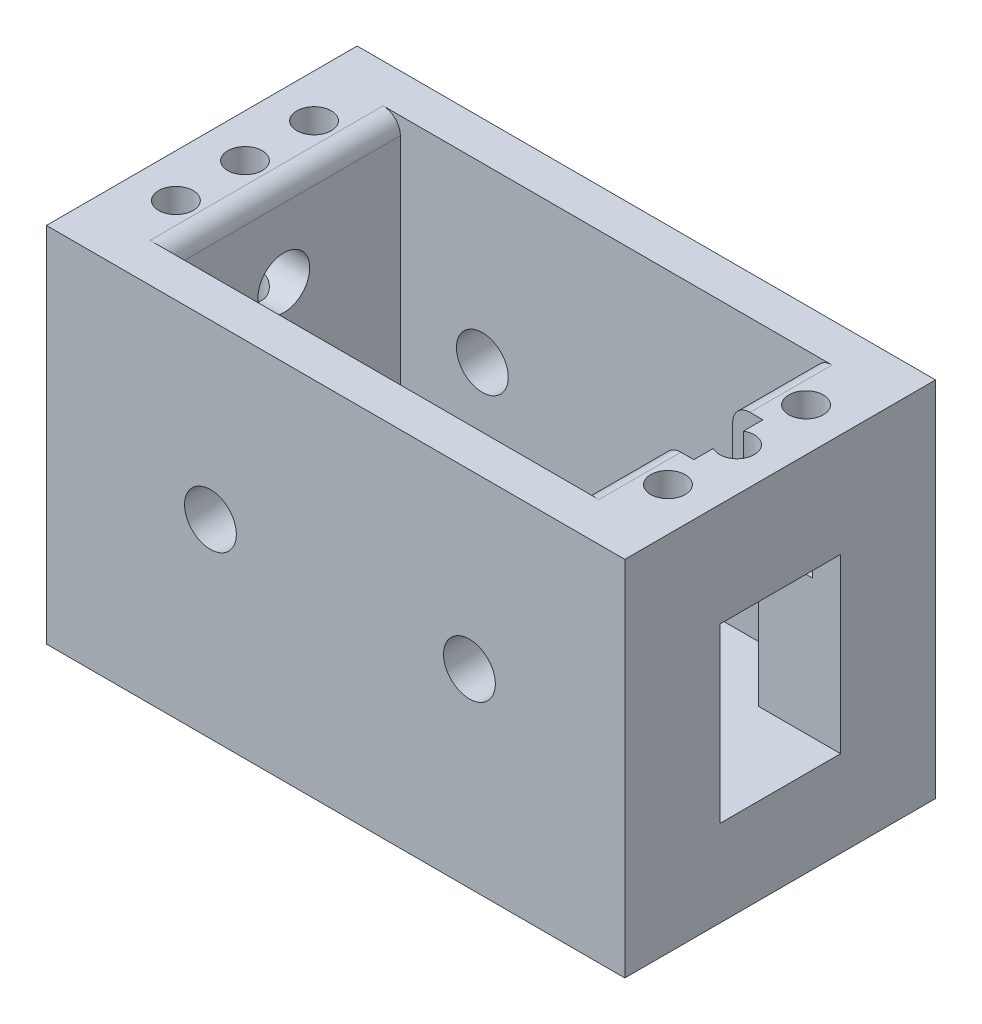
from build123d import *

# Parameters (mm, degrees)
CROQUIS1_W              = 33.5
CROQUIS1_H              = 18
SALIENTE_EXTRUIR1_DEPTH = 21
CROQUIS2_W              = 23.5
CROQUIS2_H              = 13.5
CORTAR_EXTRUIR1_DEPTH   = 16
CORTAR_EXTRUIR2_REACH   = 38.527
CROQUIS3_W              = 7
CROQUIS3_H              = 10
CROQUIS4_R              = 1
CORTAR_EXTRUIR3_DEPTH   = 8
CORTAR_EXTRUIR4_REACH   = 30.33
CROQUIS5_W              = 2
CROQUIS5_H              = 4
CORTAR_EXTRUIR5_REACH   = 26.851
CROQUIS6_R              = 1.5
CORTAR_EXTRUIR6_REACH   = 42.549
CROQUIS7_R              = 1.5
CROQUIS8_R              = 1.5
CORTAR_EXTRUIR7_DEPTH   = 33.335159
CORTAR_EXTRUIR8_REACH   = 30.33
CROQUIS9_W              = 0.25
CROQUIS9_H              = 13.5
REDONDEO1_R             = 1


with BuildPart() as part:
    # Croquis1 → Saliente-Extruir1 (new body)
    with BuildSketch(Plane(origin=(0, 0, 0), x_dir=(1, 0, 0), z_dir=(0, 1, 0))):
        Rectangle(CROQUIS1_W, CROQUIS1_H)
    extrude(amount=SALIENTE_EXTRUIR1_DEPTH)

    # Croquis2 → Cortar-Extruir1 (cut)
    with BuildSketch(Plane(origin=(0, 21, 0), x_dir=(1, 0, 0), z_dir=(0, 1, 0))):
        Rectangle(CROQUIS2_W, CROQUIS2_H)
    extrude(amount=-CORTAR_EXTRUIR1_DEPTH, mode=Mode.SUBTRACT)

    # Croquis3 → Cortar-Extruir2 (cut, up to next)
    with BuildSketch(Plane.ZY.offset(-11.75), mode=Mode.PRIVATE) as cortar_extruir2_sk1:
        with Locations((0, 10)):
            Rectangle(CROQUIS3_W, CROQUIS3_H)
    cortar_extruir2_tool1 = extrude(cortar_extruir2_sk1.sketch, amount=-CORTAR_EXTRUIR2_REACH, mode=Mode.PRIVATE) & part.part
    add(cortar_extruir2_tool1.solids().sort_by_distance((11.75, 10, 0))[0], mode=Mode.SUBTRACT)

    # Croquis4 → Cortar-Extruir3 (cut)
    with BuildSketch(Plane(origin=(0, 21, 0), x_dir=(1, 0, 0), z_dir=(0, 1, 0))):
        with Locations(Location((14.25, 0, 0), (0, 0, 270))):
            Circle(CROQUIS4_R)
        with Locations(Location((14.25, 4, 0), (0, 0, 270))):
            Circle(CROQUIS4_R)
        with Locations(Location((14.25, -4, 0), (0, 0, 30))):
            Circle(CROQUIS4_R)
        with Locations(Location((-14.25, -4, 0), (0, 0, 270))):
            Circle(CROQUIS4_R)
        with Locations(Location((-14.25, 0, 0), (0, 0, 90))):
            Circle(CROQUIS4_R)
        with Locations(Location((-14.25, 4, 0), (0, 0, 90))):
            Circle(CROQUIS4_R)
    extrude(amount=-CORTAR_EXTRUIR3_DEPTH, mode=Mode.SUBTRACT)

    # Croquis5 → Cortar-Extruir4 (cut, up to next)
    with BuildSketch(Plane(origin=(0, 21, 0), x_dir=(1, 0, 0), z_dir=(0, 1, 0)), mode=Mode.PRIVATE) as cortar_extruir4_sk1:
        with Locations((12.75, 0)):
            Rectangle(CROQUIS5_W, CROQUIS5_H)
    cortar_extruir4_tool1 = extrude(cortar_extruir4_sk1.sketch, amount=-CORTAR_EXTRUIR4_REACH, mode=Mode.PRIVATE) & part.part
    add(cortar_extruir4_tool1.solids().sort_by_distance((12.75, 21, 0))[0], mode=Mode.SUBTRACT)

    # Croquis6 → Cortar-Extruir5 (cut, up to next)
    with BuildSketch(Plane(origin=(0, 5, 0), x_dir=(1, 0, 0), z_dir=(0, 1, 0)), mode=Mode.PRIVATE) as cortar_extruir5_sk1:
        with Locations(Location((4.75, 0, 0), (0, 0, 270))):
            Circle(CROQUIS6_R)
    cortar_extruir5_tool1 = extrude(cortar_extruir5_sk1.sketch, amount=-CORTAR_EXTRUIR5_REACH, mode=Mode.PRIVATE) & part.part
    add(cortar_extruir5_tool1.solids().sort_by_distance((4.75, 5, 0))[0], mode=Mode.SUBTRACT)

    # Croquis7 → Cortar-Extruir6 (cut, up to next)
    with BuildSketch(Plane.ZY.offset(16.75), mode=Mode.PRIVATE) as cortar_extruir6_sk1:
        with Locations((0, 16)):
            Circle(CROQUIS7_R)
    cortar_extruir6_tool1 = extrude(cortar_extruir6_sk1.sketch, amount=-CORTAR_EXTRUIR6_REACH, mode=Mode.PRIVATE) & part.part
    # Croquis7 → Cortar-Extruir6 (cut, up to next)
    with BuildSketch(Plane.ZY.offset(16.75), mode=Mode.PRIVATE) as cortar_extruir6_sk2:
        with Locations((0, 9)):
            Circle(CROQUIS7_R)
    cortar_extruir6_tool2 = extrude(cortar_extruir6_sk2.sketch, amount=-CORTAR_EXTRUIR6_REACH, mode=Mode.PRIVATE) & part.part
    add(cortar_extruir6_tool1.solids().sort_by_distance((-16.75, 16, 0))[0], mode=Mode.SUBTRACT)
    add(cortar_extruir6_tool2.solids().sort_by_distance((-16.75, 9, 0))[0], mode=Mode.SUBTRACT)

    # Croquis8 → Cortar-Extruir7 (cut, through all)
    with BuildSketch(Plane(origin=(0, 0, -9), x_dir=(-1, 0, 0), z_dir=(0, 0, -1))):
        with Locations((-7.75, 11)):
            Circle(CROQUIS8_R)
        with Locations((7.25, 11)):
            Circle(CROQUIS8_R)
    extrude(amount=-CORTAR_EXTRUIR7_DEPTH, mode=Mode.SUBTRACT)

    # Cortar-Extruir8: up to this face of the body (flat: up to its plane)
    cortar_extruir8_end = Plane(part.part.faces().sort_by_distance((1.347622457, 5, 0))[0])
    # Croquis9 → Cortar-Extruir8 (cut, up to the picked face)
    with BuildSketch(Plane(origin=(0, 21, 0), x_dir=(1, 0, 0), z_dir=(0, 1, 0)), mode=Mode.PRIVATE) as cortar_extruir8_sk1:
        with Locations((-11.875, 0)):
            Rectangle(CROQUIS9_W, CROQUIS9_H)
    cortar_extruir8_tool1 = split(extrude(cortar_extruir8_sk1.sketch, amount=-CORTAR_EXTRUIR8_REACH, mode=Mode.PRIVATE), bisect_by=cortar_extruir8_end, keep=Keep.BOTH, mode=Mode.PRIVATE)
    # Croquis9 → Cortar-Extruir8 (cut, up to the picked face)
    with BuildSketch(Plane(origin=(0, 21, 0), x_dir=(1, 0, 0), z_dir=(0, 1, 0)), mode=Mode.PRIVATE) as cortar_extruir8_sk2:
        with Locations((11.875, 0)):
            Rectangle(CROQUIS9_W, CROQUIS9_H)
    cortar_extruir8_tool2 = split(extrude(cortar_extruir8_sk2.sketch, amount=-CORTAR_EXTRUIR8_REACH, mode=Mode.PRIVATE), bisect_by=cortar_extruir8_end, keep=Keep.BOTH, mode=Mode.PRIVATE)
    add(cortar_extruir8_tool1.solids().sort_by(Axis((-11.875, 21, 0), (0, -1, 0)))[0], mode=Mode.SUBTRACT)
    add(cortar_extruir8_tool2.solids().sort_by(Axis((11.875, 21, 0), (0, -1, 0)))[0], mode=Mode.SUBTRACT)

    # Redondeo1
    redondeo1_edges = [part.edges().sort_by_distance(p)[0] for p in [
        (-12, 21, 0),
        (12, 21, -4.375),
        (12, 21, 4.375),
    ]]
    fillet(redondeo1_edges, radius=REDONDEO1_R)


solid = part.part
